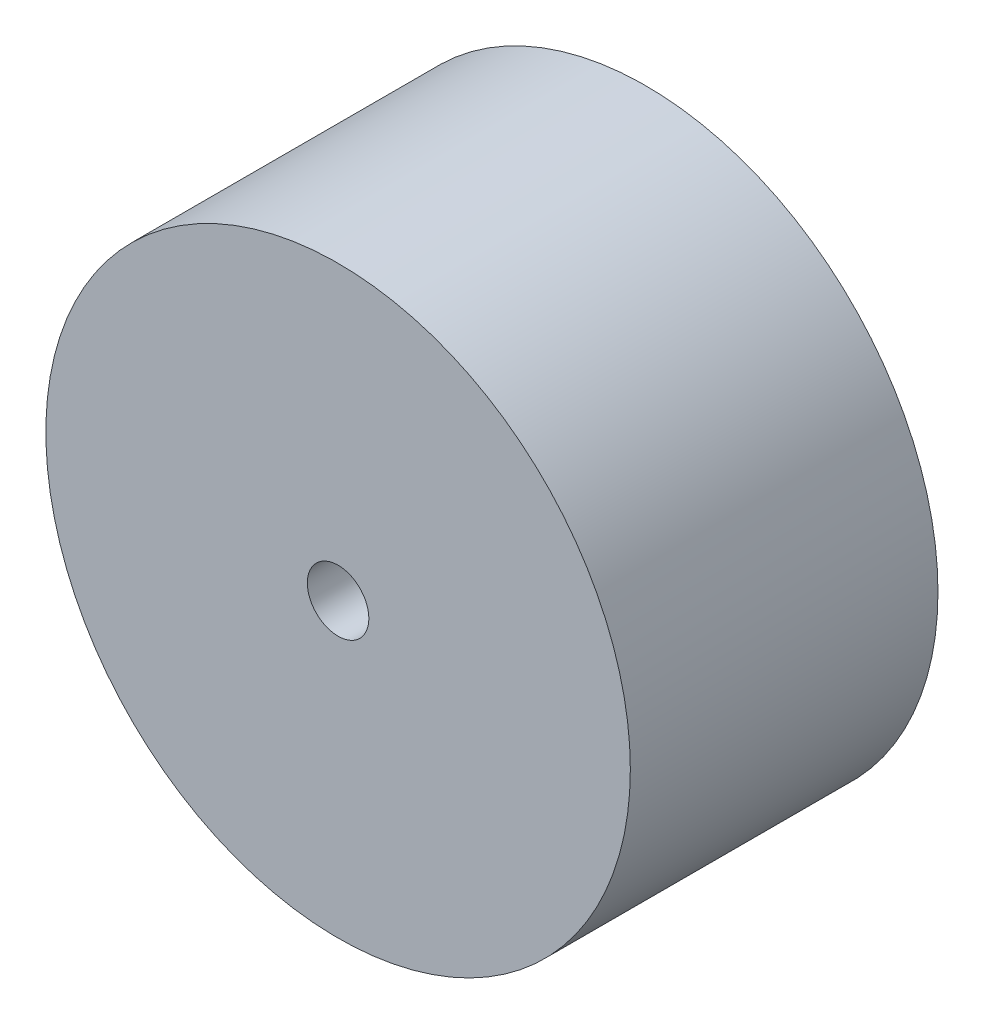
from build123d import *

# Parameters (mm, degrees)
SKETCH1_R           = 19
BOSS_EXTRUDE1_DEPTH = 20
SKETCH2_R           = 2
CUT_EXTRUDE1_DEPTH  = 34.496268449


with BuildPart() as part:
    # Sketch1 → Boss-Extrude1 (new body)
    with BuildSketch(Plane.XY):
        Circle(SKETCH1_R)
    extrude(amount=BOSS_EXTRUDE1_DEPTH)

    # Sketch2 → Cut-Extrude1 (cut, through all)
    with BuildSketch(Plane.XY.offset(20)):
        Circle(SKETCH2_R)
    extrude(amount=-CUT_EXTRUDE1_DEPTH, mode=Mode.SUBTRACT)


solid = part.part
